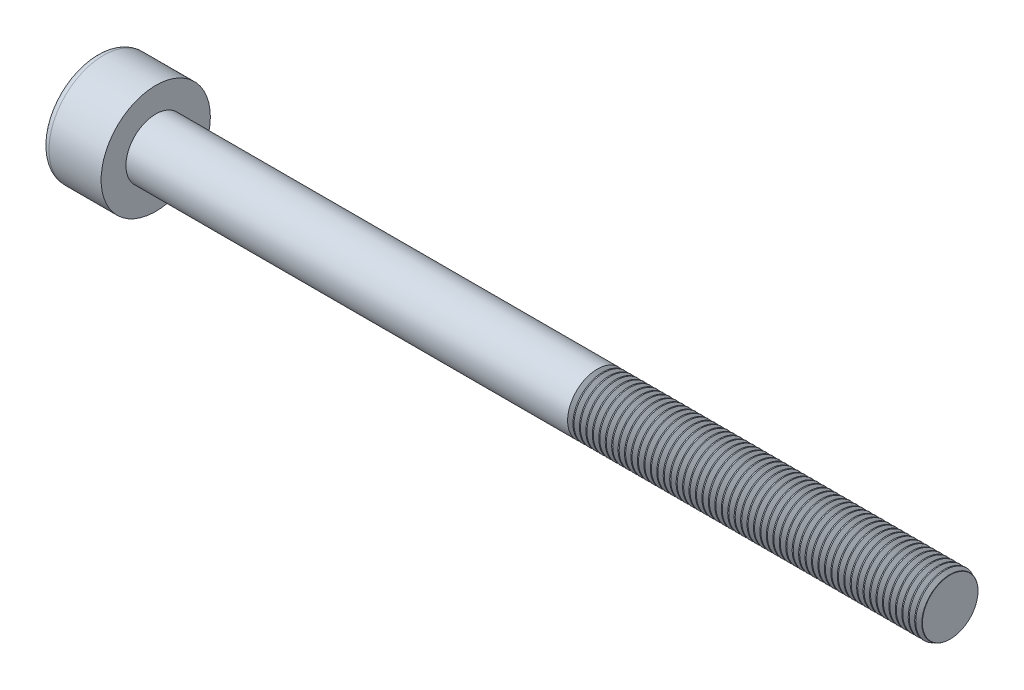
from build123d import *

# Parameters (mm, degrees)
SKETCH1_R           = 2.75
BASEHEAD_DEPTH      = 3
SKETCH2_R           = 1.5
BASEBODY_DEPTH      = 40
HEXAGONSOCKET_DEPTH = 1.3
TOPFILLET_R         = 0.375
CHAMFER1_SIZE       = 0.1
LPATTERN10_COUNT    = 55
LPATTERN10_PITCH    = 0.3246


with BuildPart() as part:
    # Sketch1 → BaseHead (new body)
    with BuildSketch(Plane(origin=(0, 0, 0), x_dir=(0, 0, -1), z_dir=(1, 0, 0))):
        Circle(SKETCH1_R)
    extrude(amount=BASEHEAD_DEPTH)

    # Sketch2 → BaseBody (add)
    with BuildSketch(Plane(origin=(3, 0, 0), x_dir=(0, 0, -1), z_dir=(1, 0, 0))):
        Circle(SKETCH2_R)
    extrude(amount=BASEBODY_DEPTH)

    # Sketch3 → HexagonSocket (cut)
    with BuildSketch(Plane(origin=(0, 0, 0), x_dir=(0, 0, -1), z_dir=(1, 0, 0))):
        Polygon((1.443375673, 0), (0.721687836, 1.25), (-0.721687836, 1.25), (-1.443375673, 0), (-0.721687836, -1.25), (0.721687836, -1.25), align=None)
    extrude(amount=HEXAGONSOCKET_DEPTH, mode=Mode.SUBTRACT)

    # Sketch4 → Cut-Revolve1 (revolve, cut)
    with BuildSketch(Plane(origin=(-4.19613823, 0.75, 0), x_dir=(-1, 0, 0), z_dir=(0, 0, 1)), mode=Mode.PRIVATE) as cut_revolve1_sk:
        Polygon((-5.49613823, 2), (-6.217826066, 0.75), (-5.49613823, 0.75), align=None)
    revolve(cut_revolve1_sk.sketch.rotate(Axis((0.838992387, 0, 0), (-1, 0, 0)), 90), axis=Axis((0.838992387, 0, 0), (-1, 0, 0)), mode=Mode.SUBTRACT)

    # TopFillet
    topfillet_edges = [part.edges().sort_by_distance(p)[0] for p in [
        (0, 0, 2.75),
    ]]
    fillet(topfillet_edges, radius=TOPFILLET_R)

    # Chamfer1
    chamfer1_edges = [part.edges().sort_by_distance(p)[0] for p in [
        (43, 0, 1.5),
    ]]
    chamfer(chamfer1_edges, length=CHAMFER1_SIZE)

    # Sketch5 → Cut-Revolve10 (revolve, cut)
    with BuildSketch(Plane.XY, mode=Mode.PRIVATE) as cut_revolve10_sk:
        Polygon((42.9, 1.265740128), (43.03525, 1.5), (43.03525, 1.7705), (42.76475, 1.7705), (42.76475, 1.5), align=None)
    cut_revolve10 = revolve(cut_revolve10_sk.sketch.rotate(Axis((0, 0, 0), (1, 0, 0)), 90), axis=Axis((0, 0, 0), (1, 0, 0)), mode=Mode.SUBTRACT)

    # LPattern10: Cut-Revolve10 ×55
    with Locations(*[(-i * LPATTERN10_PITCH, 0, 0) for i in range(1, LPATTERN10_COUNT)]):
        add(cut_revolve10, mode=Mode.SUBTRACT)


solid = part.part
